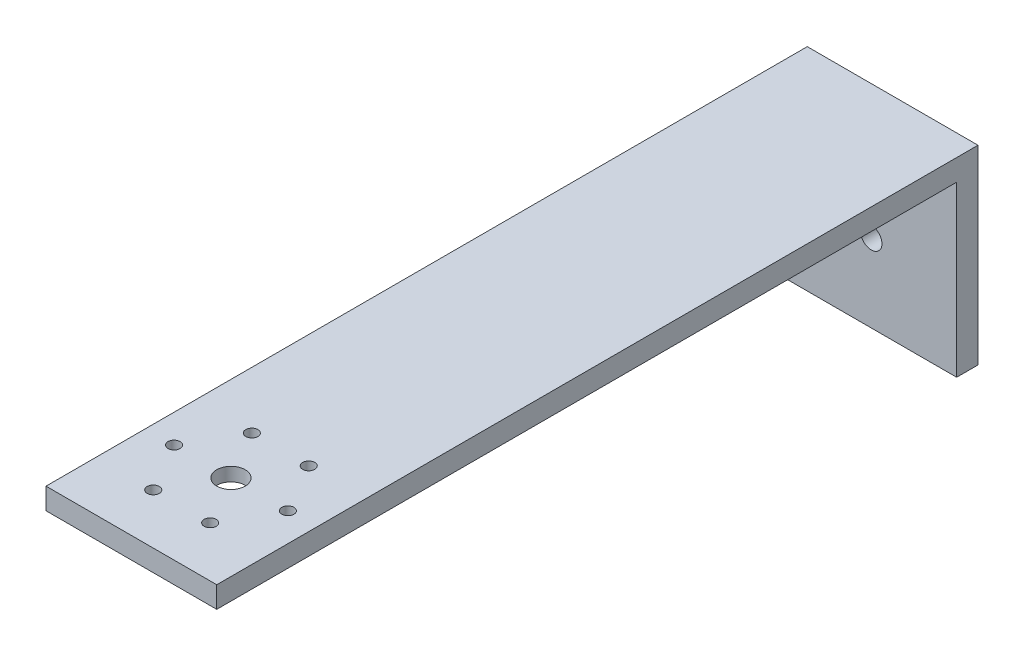
from build123d import *

# Parameters (mm, degrees)
SK_FOREARM_PLATE_W       = 48
SK_FOREARM_PLATE_H       = 208
SK_FOREARM_PLATE_R       = 1.7
SK_FOREARM_PLATE_R_2     = 4
FOREARM_PLATE_DEPTH      = 6
SK_ELBOW_PILOT_RECESS_R  = 12.15
ELBOW_PILOT_RECESS_DEPTH = 2.2
SK_HAND_PLATE_W          = 48
SK_HAND_PLATE_H          = 53.5
SK_HAND_PLATE_R          = 3
HAND_PLATE_DEPTH         = 6


with BuildPart() as part:
    # SK_Forearm_Plate → Forearm_Plate (new body)
    with BuildSketch(Plane(origin=(0, 25.5, 0), x_dir=(1, 0, 0), z_dir=(0, 1, 0))):
        with Locations((0, 76)):
            Rectangle(SK_FOREARM_PLATE_W, SK_FOREARM_PLATE_H)
        with Locations(Location((16, 0, 0), (0, 0, 270))):
            Circle(SK_FOREARM_PLATE_R, mode=Mode.SUBTRACT)
        with Locations(Location((8, 13.856406461, 0), (0, 0, 270))):
            Circle(SK_FOREARM_PLATE_R, mode=Mode.SUBTRACT)
        with Locations(Location((-8, 13.856406461, 0), (0, 0, 270))):
            Circle(SK_FOREARM_PLATE_R, mode=Mode.SUBTRACT)
        with Locations(Location((-16, 0, 0), (0, 0, 270))):
            Circle(SK_FOREARM_PLATE_R, mode=Mode.SUBTRACT)
        with Locations(Location((-8, -13.856406461, 0), (0, 0, 270))):
            Circle(SK_FOREARM_PLATE_R, mode=Mode.SUBTRACT)
        with Locations(Location((8, -13.856406461, 0), (0, 0, 270))):
            Circle(SK_FOREARM_PLATE_R, mode=Mode.SUBTRACT)
        with Locations(Location((0, 0, 0), (0, 0, 270))):
            Circle(SK_FOREARM_PLATE_R_2, mode=Mode.SUBTRACT)
    extrude(amount=FOREARM_PLATE_DEPTH)

    # SK_Elbow_Pilot_Recess → Elbow_Pilot_Recess (cut)
    with BuildSketch(Plane(origin=(0, 25.5, 0), x_dir=(1, 0, 0), z_dir=(0, 1, 0))):
        with Locations(Location((0, 0, 0), (0, 0, 270))):
            Circle(SK_ELBOW_PILOT_RECESS_R)
    extrude(amount=ELBOW_PILOT_RECESS_DEPTH, mode=Mode.SUBTRACT)

    # SK_Hand_Plate → Hand_Plate (add)
    with BuildSketch(Plane.XY.offset(-186)):
        with Locations((0, 4.75)):
            Rectangle(SK_HAND_PLATE_W, SK_HAND_PLATE_H)
        Circle(SK_HAND_PLATE_R, mode=Mode.SUBTRACT)
    extrude(amount=HAND_PLATE_DEPTH)


solid = part.part
